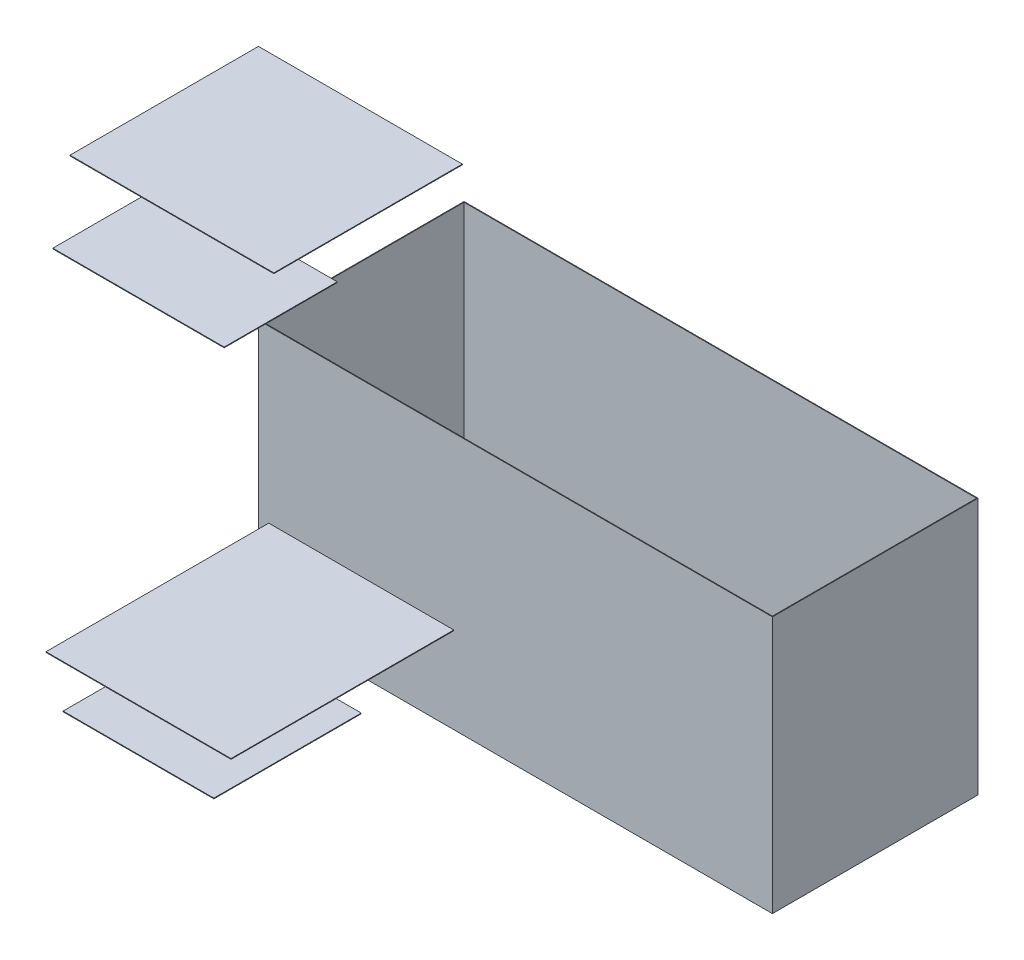
from build123d import *

# Parameters (mm, degrees)
MASTER_FOOTPRINT_W            = 1500
MASTER_FOOTPRINT_H            = 600
BATH_BASE_PLATE_DEPTH         = 750
BATH_SHELL_2MM_T              = -2
INLET_IMPACT_BAFFLE_START     = 125
SKETCH_1_W                    = 440
SKETCH_1_H                    = 430
INLET_IMPACT_BAFFLE_DEPTH     = 2
OUTLET_SUBMERGED_BAFFLE_START = 1280
SKETCH_3_W                    = 500
SKETCH_3_H                    = 330
OUTLET_SUBMERGED_BAFFLE_DEPTH = 2
OVERFLOW_WEIR_Z550_START      = 1440
SKETCH_4_W                    = 595
SKETCH_4_H                    = 550
OVERFLOW_WEIR_Z550_DEPTH      = 2
DISTRIBUTOR_SOLID_PANEL_START = 250
SKETCH_5_W                    = 540
SKETCH_5_H                    = 652
DISTRIBUTOR_SOLID_PANEL_DEPTH = 2


with BuildPart() as part:
    # MASTER_FOOTPRINT → BATH_BASE_PLATE (new body)
    with BuildSketch(Plane(origin=(0, 0, 0), x_dir=(1, 0, 0), z_dir=(0, 1, 0))):
        with Locations((750, 300)):
            Rectangle(MASTER_FOOTPRINT_W, MASTER_FOOTPRINT_H)
    extrude(amount=BATH_BASE_PLATE_DEPTH)

    # BATH_SHELL_2MM
    bath_shell_2mm_openings = [part.faces().sort_by_distance(p)[0] for p in [
        (750, 750, -300),
    ]]
    offset(amount=BATH_SHELL_2MM_T, openings=bath_shell_2mm_openings, kind=Kind.INTERSECTION)


with BuildPart() as body_2:
    # Эскиз1 → INLET_IMPACT_BAFFLE (new body)
    with BuildSketch(Plane(origin=(0, 0, 0), x_dir=(1, 0, 0), z_dir=(0, 1, 0)).offset(INLET_IMPACT_BAFFLE_START)):
        with Locations((300, -435)):
            Rectangle(SKETCH_1_W, SKETCH_1_H)
    extrude(amount=INLET_IMPACT_BAFFLE_DEPTH)


with BuildPart() as body_3:
    # Эскиз3 → OUTLET_SUBMERGED_BAFFLE (new body)
    with BuildSketch(Plane(origin=(0, 0, 0), x_dir=(1, 0, 0), z_dir=(0, 1, 0)).offset(OUTLET_SUBMERGED_BAFFLE_START)):
        with Locations((300, -485)):
            Rectangle(SKETCH_3_W, SKETCH_3_H)
    extrude(amount=OUTLET_SUBMERGED_BAFFLE_DEPTH)


with BuildPart() as body_4:
    # Эскиз4 → OVERFLOW_WEIR_Z550 (new body)
    with BuildSketch(Plane(origin=(0, 0, 0), x_dir=(1, 0, 0), z_dir=(0, 1, 0)).offset(OVERFLOW_WEIR_Z550_START)):
        with Locations((297.5, -275)):
            Rectangle(SKETCH_4_W, SKETCH_4_H)
    extrude(amount=OVERFLOW_WEIR_Z550_DEPTH)


with BuildPart() as body_5:
    # Эскиз5 → DISTRIBUTOR_SOLID_PANEL (new body)
    with BuildSketch(Plane(origin=(0, 0, 0), x_dir=(1, 0, 0), z_dir=(0, 1, 0)).offset(DISTRIBUTOR_SOLID_PANEL_START)):
        with Locations((300, -324)):
            Rectangle(SKETCH_5_W, SKETCH_5_H)
    extrude(amount=DISTRIBUTOR_SOLID_PANEL_DEPTH)


solid = Compound([part.part, body_2.part, body_3.part, body_4.part, body_5.part])
